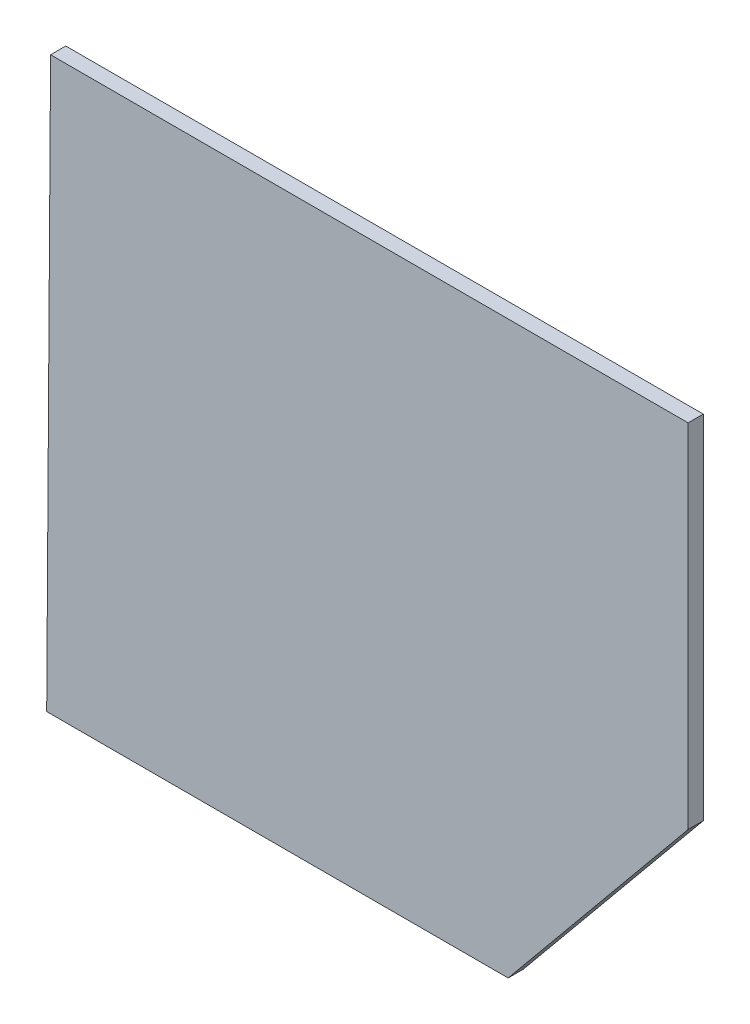
from build123d import *

# Parameters (mm, degrees)
BOSS_EXTRUDE1_DEPTH = 3.175


with BuildPart() as part:
    # Sketch1 → Boss-Extrude1 (new body)
    with BuildSketch(Plane.XY):
        Polygon((-1993.5728, -105.089720641), (-1955.927960592, -59.369720641), (-1955.927960592, 14.290279359), (-2089.277960592, 14.290279359), (-2090.0928, -105.089720641), align=None)
    extrude(amount=BOSS_EXTRUDE1_DEPTH)


solid = part.part
